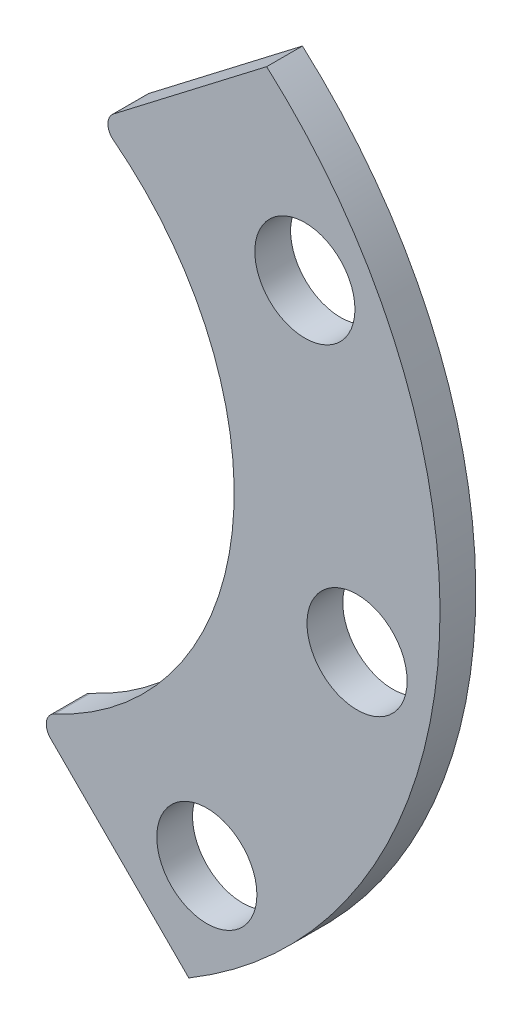
from build123d import *

# Parameters (mm, degrees)
SKETCH6_R           = 6.5
SKETCH6_R_2         = 4.445
BOSS_EXTRUDE3_DEPTH = 3.175


with BuildPart() as part:
    # Sketch6 → Boss-Extrude3 (new body)
    # profile 1 of 4: a face of its own
    with BuildSketch(Plane.XY):
        with BuildLine():
            Line((16.779877408, 23.796523986), (30.381235635, 34.235995151))
            ThreePointArc((30.381235635, 34.235995151), (45.571708019, -4.282787757), (23.47067629, -39.296948955))
            Line((23.47067629, -39.296948955), (11.181031284, -27.004389661))
            ThreePointArc((11.181031284, -27.004389661), (10.828800328, -25.884001858), (11.545866958, -24.953866964))
            ThreePointArc((11.545866958, -24.953866964), (27.324797823, -3.059075709), (16.778161303, 21.782925045))
            ThreePointArc((16.778161303, 21.782925045), (16.283134573, 22.790147137), (16.779877408, 23.796523986))
        make_face()
        with Locations((33.774990729, 19.499999989)):
            Circle(SKETCH6_R, mode=Mode.SUBTRACT)
        with Locations((25.068716764, -29.875733265)):
            Circle(SKETCH6_R, mode=Mode.SUBTRACT)
        with Locations((38.407502346, -6.772278925)):
            Circle(SKETCH6_R, mode=Mode.SUBTRACT)
    # profile 2 of 4: a face of its own
    with BuildSketch(Plane.XY):
        with Locations((25.068716764, -29.875733265)):
            Circle(SKETCH6_R)
        with Locations((25.068716764, -29.875733265)):
            Circle(SKETCH6_R_2, mode=Mode.SUBTRACT)
    # profile 3 of 4: a face of its own
    with BuildSketch(Plane.XY):
        with Locations((38.407502346, -6.772278925)):
            Circle(SKETCH6_R)
        with Locations((38.407502346, -6.772278925)):
            Circle(SKETCH6_R_2, mode=Mode.SUBTRACT)
    # profile 4 of 4: a face of its own
    with BuildSketch(Plane.XY):
        with Locations((33.774990729, 19.499999989)):
            Circle(SKETCH6_R)
        with Locations((33.774990729, 19.499999989)):
            Circle(SKETCH6_R_2, mode=Mode.SUBTRACT)
    extrude(amount=BOSS_EXTRUDE3_DEPTH)


solid = part.part
